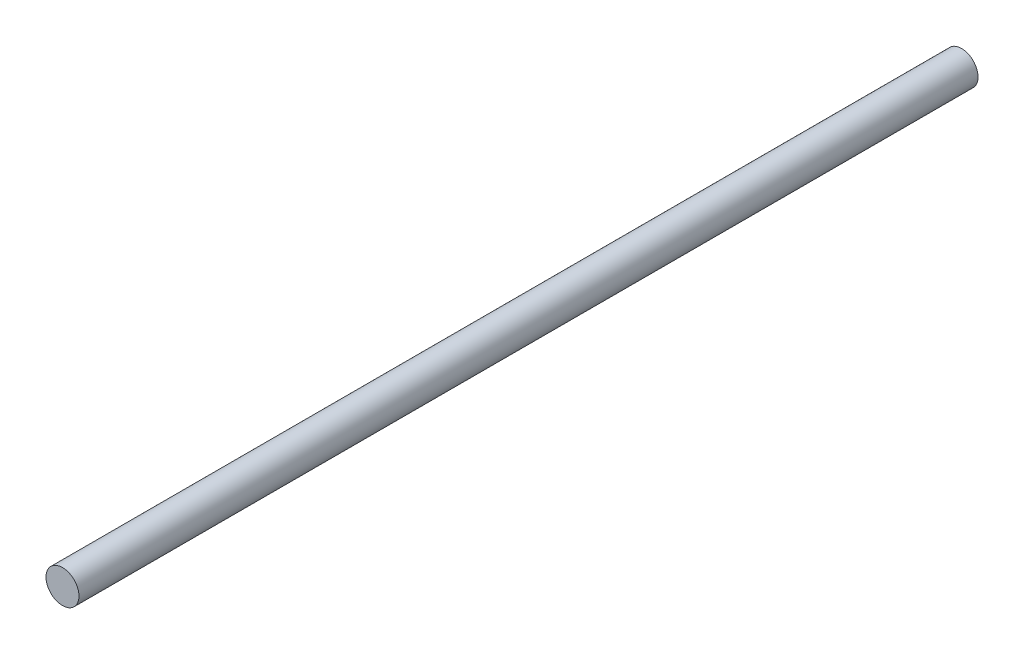
from build123d import *

# Parameters (mm, degrees)
SKETCH1_R      = 0.6985
EXTRUDE1_DEPTH = 38.1


with BuildPart() as part:
    # Sketch1 → Extrude1 (new body)
    with BuildSketch(Plane.XY):
        with Locations(Location((0, 0, 0), (0, 0, 180))):
            Circle(SKETCH1_R)
    extrude(amount=EXTRUDE1_DEPTH)


solid = part.part
